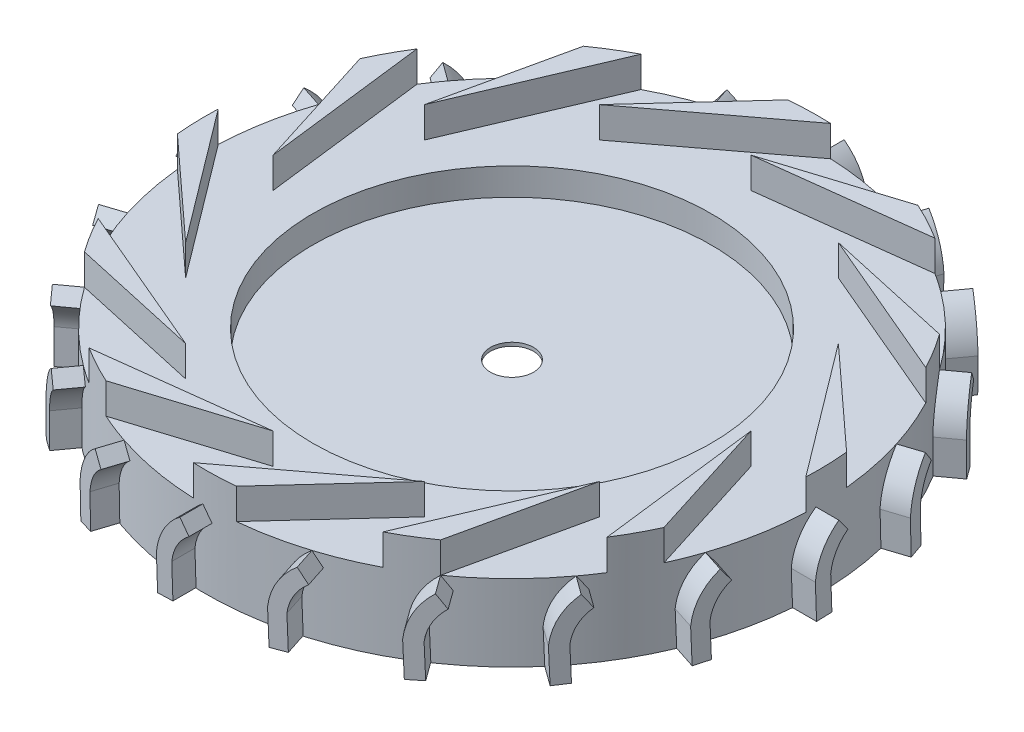
from build123d import *
from build123d.topology import SkipClean

# Parameters (mm, degrees)
BOSS_EXTRUDE1_START = 5.08
BOSS_EXTRUDE1_DEPTH = 5.08
CIRPATTERN1_COUNT   = 12
BOSS_EXTRUDE2_START = -0.254
BOSS_EXTRUDE2_DEPTH = 5.334
CIRPATTERN16_COUNT  = 20
CUT_EXTRUDE1_REACH  = 79.822
SKETCH4_R           = 3.5687
SKETCH5_R           = 38.1
CUT_EXTRUDE2_DEPTH  = 7.62


with BuildPart() as part:
    # Sketch1 → Revolve1 (revolve)
    with BuildSketch(Plane(origin=(0, 0, 0), x_dir=(0, 0, -1), z_dir=(1, 0, 0))):
        Polygon((0, -1.048543689), (-50.8, -1.048543689), (-50.8, 11.651456311), (-33.000061, 11.651456311), (-33.000061, 7.151456311), (0, 7.151456311), align=None)
    revolve(axis=Axis((0, 26.263106796, 0), (0, -1, 0)))

    # Sketch2 → Boss-Extrude1 (add)
    with BuildSketch(Plane(origin=(0, 11.651456311, 0), x_dir=(1, 0, 0), z_dir=(0, 1, 0)).offset(BOSS_EXTRUDE1_START)):
        with BuildLine():
            Line((0, 39.6000732), (21.045325156, 46.235638733))
            ThreePointArc((21.045325156, 46.235638733), (24.162882711, 44.685513302), (27.166939829, 42.925486373))
            Line((27.166939829, 42.925486373), (0, 39.6000732))
        make_face()
    boss_extrude1 = extrude(amount=-BOSS_EXTRUDE1_DEPTH)

    # CirPattern1: Boss-Extrude1 ×12 about axis
    cirpattern1_axis = Axis((0, 0, 0), (0, 1, 0))
    for i in range(1, CIRPATTERN1_COUNT):
        add(boss_extrude1.rotate(cirpattern1_axis, i * 360 / CIRPATTERN1_COUNT))

    # Sketch3 → Boss-Extrude2 (add)
    with BuildSketch(Plane.XY.offset(49.53).offset(BOSS_EXTRUDE2_START)):
        with BuildLine():
            Line((-4.328705217, 4.692283102), (-4.128739972, -1.048543689))
            Line((-4.128739972, -1.048543689), (-1.590279434, -0.960123693))
            Line((-1.590279434, -0.960123693), (-1.784517886, 4.616291902))
            ThreePointArc((-1.784517886, 4.616291902), (-0.880879448, 7.412924512), (1.072935762, 9.608447799))
            Line((1.072935762, 9.608447799), (-0.436274701, 11.651456311))
            ThreePointArc((-0.436274701, 11.651456311), (-3.132472812, 8.591352892), (-4.328705217, 4.692283102))
        make_face()
    boss_extrude2 = extrude(amount=BOSS_EXTRUDE2_DEPTH)

    # CirPattern16: Boss-Extrude2 ×20 about axis
    with SkipClean():  # the faces are left unmerged after this step: merging them gives an invalid solid
        cirpattern16_axis = Axis((0, 0, 0), (0, 1, 0))
        for i in range(1, CIRPATTERN16_COUNT):
            add(boss_extrude2.rotate(cirpattern16_axis, i * 360 / CIRPATTERN16_COUNT))

    # Sketch4 → Cut-Extrude1 (cut, up to next)
    with BuildSketch(Plane(origin=(0, 7.151456311, 0), x_dir=(1, 0, 0), z_dir=(0, 1, 0)), mode=Mode.PRIVATE) as cut_extrude1_sk1:
        with Locations(Location((0, 0, 0), (0, 0, 270))):
            Circle(SKETCH4_R)
    cut_extrude1_tool1 = extrude(cut_extrude1_sk1.sketch, amount=-CUT_EXTRUDE1_REACH, mode=Mode.PRIVATE) & part.part
    add(cut_extrude1_tool1.solids().sort_by_distance((0, 7.151456, 0))[0], mode=Mode.SUBTRACT)

    # Sketch5 → Cut-Extrude2 (cut)
    with SkipClean():  # the faces are left unmerged after this step: merging them gives an invalid solid
        with BuildSketch(Plane(origin=(0, -1.048543689, 0), x_dir=(-1, 0, 0), z_dir=(0, -1, 0))):
            with Locations(Location((0, 0, 0), (0, 0, 90))):
                Circle(SKETCH5_R)
        extrude(amount=-CUT_EXTRUDE2_DEPTH, mode=Mode.SUBTRACT)


solid = part.part
